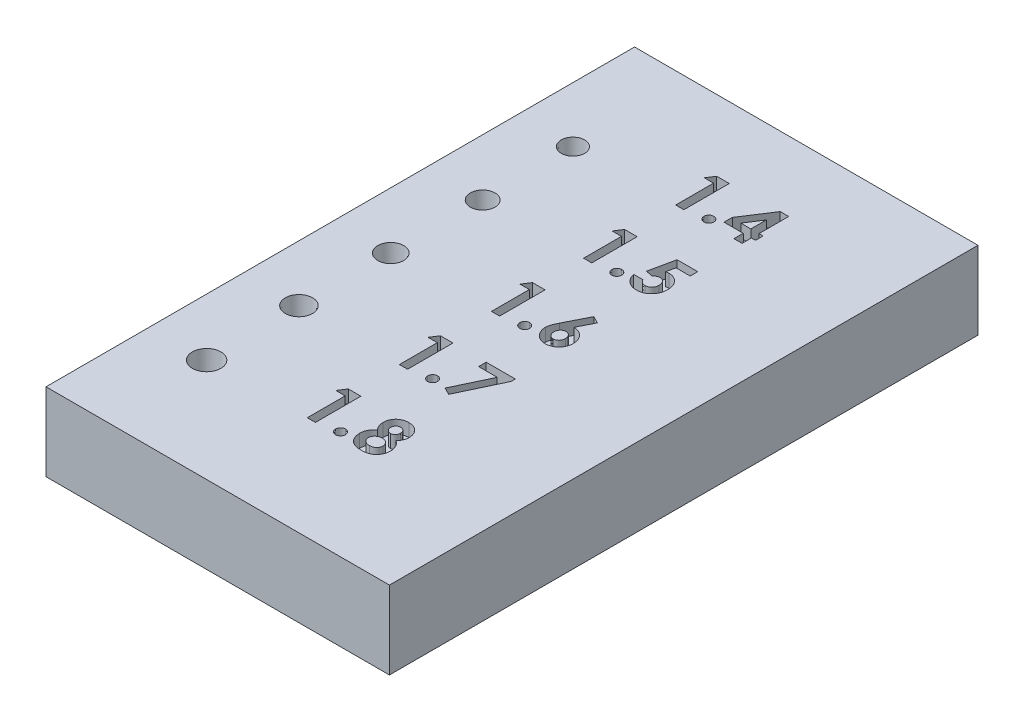
from build123d import *

# Parameters (mm, degrees)
SKETCH1_W           = 26.454374799
SKETCH1_H           = 45.335715324
BOSS_EXTRUDE1_DEPTH = 6
CUT_EXTRUDE1_DEPTH  = 1


with BuildPart() as part:
    # Sketch1 → Boss-Extrude1 (new body)
    with BuildSketch(Plane(origin=(0, 0, 0), x_dir=(1, 0, 0), z_dir=(0, 1, 0))):
        with Locations((13.227187399, 22.667857662)):
            Rectangle(SKETCH1_W, SKETCH1_H)
    extrude(amount=BOSS_EXTRUDE1_DEPTH)

    # Sketch4 → Cut-Extrude1 (cut)
    # profile 1 of 15: a face of its own
    with BuildSketch(Plane(origin=(0, 6, 0), x_dir=(1, 0, 0), z_dir=(0, 1, 0))):
        Polygon((16.587292701, 39.965877523), (17.242140457, 39.965877523), (17.242140457, 37.677415984), (17.556243021, 37.677415984), (17.556243021, 37.094082651), (17.242140457, 37.094082651), (17.242140457, 36.376133933), (16.613935329, 36.376133933), (16.613935329, 37.094082651), (15.133166098, 37.094082651), (15.133166098, 37.730000119), align=None)
        Polygon((16.613935329, 37.677415984), (16.613935329, 38.868621914), (15.839195746, 37.677415984), align=None, mode=Mode.SUBTRACT)
    # profile 2 of 15: a face of its own
    with BuildSketch(Plane(origin=(0, 6, 0), x_dir=(1, 0, 0), z_dir=(0, 1, 0))):
        with BuildLine():
            add(Edge.make_bspline(
                [(14.347909688, 37.094082651), (14.373269584, 37.092692229), (14.42319884, 37.089954728), (14.495339806, 37.069525043), (14.560447444, 37.032820204), (14.618662372, 36.984945104), (14.667887449, 36.927344966), (14.703466221, 36.86165905), (14.725622015, 36.789796053), (14.72806803, 36.739709714), (14.729319944, 36.714074638)],
                knots=[0, 0, 0, 0, 1.016957001, 2.002212695, 2.9757545, 3.99499976, 5.013036768, 5.994806404, 6.97370641, 8, 8, 8, 8], degree=3))
            add(Edge.make_bspline(
                [(14.729319944, 36.714074638), (14.728076232, 36.688435446), (14.72564624, 36.638341063), (14.703312905, 36.566338035), (14.667940615, 36.500112241), (14.618658423, 36.44189488), (14.560688533, 36.393117528), (14.495190113, 36.356751161), (14.423336267, 36.335162553), (14.373293773, 36.332574785), (14.347909688, 36.331262138)],
                knots=[0, 0, 0, 0, 1.023218912, 1.999186227, 2.986238111, 4.008388923, 5.030539734, 6.0011649, 6.986089706, 8, 8, 8, 8], degree=3))
            add(Edge.make_bspline(
                [(14.347909688, 36.331262138), (14.322519588, 36.332564111), (14.272465237, 36.335130836), (14.200499699, 36.356933132), (14.134517719, 36.392874732), (14.076533264, 36.441954047), (14.0270309, 36.499906089), (13.992664277, 36.566546989), (13.970122913, 36.638313917), (13.967726142, 36.688426256), (13.966499431, 36.714074638)],
                knots=[0, 0, 0, 0, 1.013427518, 1.99788335, 2.976245624, 3.997909735, 5.019573847, 6.001765691, 6.977268297, 8, 8, 8, 8], degree=3))
            add(Edge.make_bspline(
                [(13.966499431, 36.714074638), (13.967734235, 36.739719064), (13.970146819, 36.789823671), (13.992511398, 36.861447689), (14.027085979, 36.927552238), (14.076529135, 36.984885814), (14.134760049, 37.033061105), (14.200349165, 37.069345566), (14.272602594, 37.089986679), (14.322543748, 37.092702991), (14.347909688, 37.094082651)],
                knots=[0, 0, 0, 0, 1.025808215, 2.00424526, 2.981110158, 3.998665696, 5.017428914, 5.998734231, 6.983523959, 8, 8, 8, 8], degree=3))
        make_face()
    # profile 3 of 15: a face of its own
    with BuildSketch(Plane(origin=(0, 6, 0), x_dir=(1, 0, 0), z_dir=(0, 1, 0))):
        Polygon((11.783907284, 39.876133933), (12.75496097, 39.876133933), (12.75496097, 36.376133933), (12.126755842, 36.376133933), (12.126755842, 39.2928006), (11.408807124, 39.2928006), align=None)
    # profile 4 of 15: a face of its own
    with BuildSketch(Plane(origin=(0, 6, 0), x_dir=(1, 0, 0), z_dir=(0, 1, 0))):
        with BuildLine():
            Line((15.827977797, 32.78210045), (17.421627637, 32.78210045))
            Line((17.421627637, 32.78210045), (17.421627637, 32.198767116))
            Line((17.421627637, 32.198767116), (16.325774271, 32.198767116))
            Line((16.325774271, 32.198767116), (16.189055521, 31.536908142))
            add(Edge.make_bspline(
                [(16.189055521, 31.536908142), (16.207685408, 31.542096801), (16.244427372, 31.552329902), (16.299779187, 31.562592407), (16.35342281, 31.569244237), (16.388623428, 31.570131502), (16.405702156, 31.570561988)],
                knots=[0, 0, 0, 0, 1.05461699, 2.079921384, 3.068411212, 4, 4, 4, 4], degree=3))
            add(Edge.make_bspline(
                [(16.405702156, 31.570561988), (16.442918494, 31.569709197), (16.516280094, 31.568028159), (16.623598806, 31.55206962), (16.726362812, 31.526935404), (16.824257644, 31.491088827), (16.917187671, 31.444433582), (17.005265543, 31.387993813), (17.08859936, 31.321670392), (17.165708763, 31.245421795), (17.236560104, 31.161699109), (17.298161304, 31.071144165), (17.350772573, 30.97504819), (17.392617757, 30.872813851), (17.425645544, 30.76508325), (17.44951216, 30.651787349), (17.463625682, 30.532791877), (17.465528804, 30.451609774), (17.466499431, 30.410205418)],
                knots=[0, 0, 0, 0, 1.01440847, 1.999622559, 2.951875003, 3.895578053, 4.836219714, 5.782137149, 6.743708247, 7.735272588, 8.734977101, 9.730283169, 10.717124674, 11.717316708, 12.737475749, 13.78628267, 14.87096371, 16, 16, 16, 16], degree=3))
            add(Edge.make_bspline(
                [(17.466499431, 30.410205418), (17.46531331, 30.368331026), (17.462972745, 30.285700612), (17.447702703, 30.164204674), (17.420750805, 30.047838994), (17.383729676, 29.936292062), (17.334956709, 29.830383724), (17.27630054, 29.729016847), (17.206769453, 29.632943845), (17.127045786, 29.543149583), (17.040375702, 29.461075903), (16.948092521, 29.38887553), (16.850844561, 29.328119501), (16.748629476, 29.279018359), (16.642033705, 29.240170408), (16.531024897, 29.211890955), (16.415063561, 29.19567426), (16.336340881, 29.193474811), (16.296327156, 29.19235686)],
                knots=[0, 0, 0, 0, 1.06808661, 2.107647099, 3.116961351, 4.110378221, 5.100014249, 6.085620622, 7.093190682, 8.119403071, 9.144090782, 10.133780668, 11.103064255, 12.062861538, 13.020824475, 13.992378307, 14.979551724, 16, 16, 16, 16], degree=3))
            add(Edge.make_bspline(
                [(16.296327156, 29.19235686), (16.260544072, 29.193271414), (16.189972343, 29.195075105), (16.086023284, 29.206161543), (15.985804848, 29.225762468), (15.889849086, 29.254130082), (15.797146381, 29.289044139), (15.708768404, 29.332710766), (15.624229503, 29.38429849), (15.543769736, 29.442865835), (15.468696461, 29.508839678), (15.40017753, 29.581059416), (15.337798121, 29.658614755), (15.282893056, 29.742462491), (15.235634446, 29.832478745), (15.193724546, 29.927602654), (15.159420873, 30.028827616), (15.142012747, 30.099002383), (15.133166098, 30.134664552)],
                knots=[0, 0, 0, 0, 1.054957082, 2.080596141, 3.077793124, 4.061112343, 5.027190972, 5.994718051, 6.962465889, 7.943658696, 8.924948258, 9.904494768, 10.875059, 11.855380583, 12.854004648, 13.869083016, 14.917087635, 16, 16, 16, 16], degree=3))
            Line((15.133166098, 30.134664552), (15.851114816, 30.134664552))
            add(Edge.make_bspline(
                [(15.851114816, 30.134664552), (15.864238936, 30.109952121), (15.889744165, 30.061926331), (15.93826075, 29.998164878), (15.992571986, 29.943791851), (16.052187958, 29.898276012), (16.117494938, 29.86417632), (16.185831792, 29.838316691), (16.258057006, 29.82337337), (16.307245565, 29.821505306), (16.332084367, 29.820561988)],
                knots=[0, 0, 0, 0, 1.104910296, 2.147267069, 3.153527244, 4.136738762, 5.099945312, 6.05603338, 7.018353, 8, 8, 8, 8], degree=3))
            add(Edge.make_bspline(
                [(16.332084367, 29.820561988), (16.349396679, 29.821213358), (16.383458944, 29.822494938), (16.433644305, 29.829274818), (16.481548438, 29.842115759), (16.527527496, 29.859897475), (16.571704993, 29.882073285), (16.613447629, 29.9100688), (16.653481649, 29.942292675), (16.691197574, 29.979269681), (16.725357331, 30.020490441), (16.755311701, 30.064784959), (16.782095039, 30.111168999), (16.801933867, 30.161479951), (16.81818019, 30.214215511), (16.830144639, 30.269773479), (16.837294746, 30.328218744), (16.837956655, 30.368117688), (16.838294303, 30.388470642)],
                knots=[0, 0, 0, 0, 0.978869489, 1.925942215, 2.855067702, 3.774946051, 4.70828698, 5.642468714, 6.60995405, 7.609372294, 8.622401667, 9.629904756, 10.629323, 11.642352373, 12.678539694, 13.745912462, 14.850161547, 16, 16, 16, 16], degree=3))
            add(Edge.make_bspline(
                [(16.838294303, 30.388470642), (16.837902424, 30.408351158), (16.837139621, 30.447049064), (16.830829562, 30.503871453), (16.819540988, 30.557785616), (16.80416021, 30.609204496), (16.784470977, 30.657815852), (16.760409419, 30.703909043), (16.731872741, 30.747251085), (16.698707737, 30.786959577), (16.663340918, 30.823381334), (16.625345589, 30.855235513), (16.58506407, 30.88167227), (16.543748058, 30.904752327), (16.499748366, 30.92154949), (16.454054372, 30.933117077), (16.406714128, 30.941604906), (16.374424375, 30.942103597), (16.358025874, 30.94235686)],
                knots=[0, 0, 0, 0, 1.166249705, 2.270133367, 3.348514167, 4.393962215, 5.415026464, 6.420877785, 7.440098956, 8.453121383, 9.451844239, 10.415694839, 11.355045125, 12.27538808, 13.187007209, 14.108269027, 15.039275622, 16, 16, 16, 16], degree=3))
            add(Edge.make_bspline(
                [(16.358025874, 30.94235686), (16.34021329, 30.941680971), (16.304513051, 30.940326346), (16.251471431, 30.929304118), (16.199069345, 30.911466019), (16.147015385, 30.886855533), (16.095826275, 30.854648174), (16.04415111, 30.816872634), (15.993719569, 30.770784161), (15.961653792, 30.736457363), (15.945065137, 30.718699008)],
                knots=[0, 0, 0, 0, 0.88288272, 1.769486374, 2.674910571, 3.623812639, 4.617874466, 5.670434592, 6.794841017, 8, 8, 8, 8], degree=3))
            Line((15.945065137, 30.718699008), (15.416419303, 30.839993078))
            Line((15.416419303, 30.839993078), (15.827977797, 32.78210045))
        make_face()
    # profile 5 of 15: a face of its own
    with BuildSketch(Plane(origin=(0, 6, 0), x_dir=(1, 0, 0), z_dir=(0, 1, 0))):
        with BuildLine():
            add(Edge.make_bspline(
                [(14.347909688, 30.000049168), (14.373269584, 29.998658746), (14.42319884, 29.995921244), (14.495339806, 29.97549156), (14.560447444, 29.938786721), (14.618662372, 29.89091162), (14.667887449, 29.833311482), (14.703466221, 29.767625567), (14.725622015, 29.69576257), (14.72806803, 29.64567623), (14.729319944, 29.620041155)],
                knots=[0, 0, 0, 0, 1.016957001, 2.002212695, 2.9757545, 3.99499976, 5.013036768, 5.994806404, 6.97370641, 8, 8, 8, 8], degree=3))
            add(Edge.make_bspline(
                [(14.729319944, 29.620041155), (14.728076232, 29.594401963), (14.72564624, 29.544307579), (14.703312905, 29.472304551), (14.667940615, 29.406078758), (14.618658423, 29.347861397), (14.560688533, 29.299084045), (14.495190113, 29.262717678), (14.423336267, 29.24112907), (14.373293773, 29.238541302), (14.347909688, 29.237228655)],
                knots=[0, 0, 0, 0, 1.023218912, 1.999186227, 2.986238111, 4.008388923, 5.030539734, 6.0011649, 6.986089706, 8, 8, 8, 8], degree=3))
            add(Edge.make_bspline(
                [(14.347909688, 29.237228655), (14.322519588, 29.238530628), (14.272465237, 29.241097353), (14.200499699, 29.262899649), (14.134517719, 29.298841249), (14.076533264, 29.347920563), (14.0270309, 29.405872605), (13.992664277, 29.472513505), (13.970122913, 29.544280433), (13.967726142, 29.594392772), (13.966499431, 29.620041155)],
                knots=[0, 0, 0, 0, 1.013427518, 1.99788335, 2.976245624, 3.997909735, 5.019573847, 6.001765691, 6.977268297, 8, 8, 8, 8], degree=3))
            add(Edge.make_bspline(
                [(13.966499431, 29.620041155), (13.967734235, 29.64568558), (13.970146819, 29.695790188), (13.992511398, 29.767414206), (14.027085979, 29.833518755), (14.076529135, 29.89085233), (14.134760049, 29.939027622), (14.200349165, 29.975312082), (14.272602594, 29.995953196), (14.322543748, 29.998669508), (14.347909688, 30.000049168)],
                knots=[0, 0, 0, 0, 1.025808215, 2.00424526, 2.981110158, 3.998665696, 5.017428914, 5.998734231, 6.983523959, 8, 8, 8, 8], degree=3))
        make_face()
    # profile 6 of 15: a face of its own
    with BuildSketch(Plane(origin=(0, 6, 0), x_dir=(1, 0, 0), z_dir=(0, 1, 0))):
        Polygon((11.783907284, 32.78210045), (12.75496097, 32.78210045), (12.75496097, 29.28210045), (12.126755842, 29.28210045), (12.126755842, 32.198767116), (11.408807124, 32.198767116), align=None)
    # profile 7 of 15: a face of its own
    with BuildSketch(Plane(origin=(0, 6, 0), x_dir=(1, 0, 0), z_dir=(0, 1, 0))):
        with BuildLine():
            Line((16.420425713, 25.777810556), (16.976415297, 25.495959595))
            Line((16.976415297, 25.495959595), (16.366439335, 24.297041326))
            add(Edge.make_bspline(
                [(16.366439335, 24.297041326), (16.402476143, 24.296108314), (16.473456545, 24.294270596), (16.577889804, 24.279417849), (16.677729943, 24.25374101), (16.773983647, 24.219706429), (16.865474305, 24.173997649), (16.953675425, 24.119624671), (17.0363052, 24.053310976), (17.115258259, 23.97983892), (17.18704987, 23.898442442), (17.249413576, 23.81097934), (17.303762445, 23.719577602), (17.346011068, 23.622192351), (17.380090215, 23.520437856), (17.404679819, 23.413907363), (17.418708876, 23.302292381), (17.420643016, 23.226467268), (17.421627637, 23.187866646)],
                knots=[0, 0, 0, 0, 1.013260694, 1.995783107, 2.958651975, 3.908806537, 4.861209129, 5.829647963, 6.817170299, 7.835534541, 8.860094905, 9.863329007, 10.853101798, 11.844815043, 12.84250023, 13.867713965, 14.914507806, 16, 16, 16, 16], degree=3))
            add(Edge.make_bspline(
                [(17.421627637, 23.187866646), (17.420704965, 23.150657988), (17.41888124, 23.077112425), (17.403805735, 22.969092699), (17.379442927, 22.865454089), (17.344623583, 22.766403574), (17.30036538, 22.671456992), (17.246240596, 22.580670059), (17.18180037, 22.494721196), (17.10870966, 22.414067094), (17.028808906, 22.340550284), (16.944589158, 22.275204264), (16.855336751, 22.221225973), (16.762738658, 22.17564004), (16.665090092, 22.141623059), (16.563852369, 22.115946131), (16.458257773, 22.101129429), (16.386582867, 22.099266212), (16.350313534, 22.098323377)],
                knots=[0, 0, 0, 0, 1.049934834, 2.075270938, 3.072134561, 4.05064612, 5.033440221, 6.024524368, 7.028587226, 8.060776465, 9.092543989, 10.090062252, 11.064205434, 12.031961459, 12.998029633, 13.977230324, 14.976426867, 16, 16, 16, 16], degree=3))
            add(Edge.make_bspline(
                [(16.350313534, 22.098323377), (16.312386833, 22.099097112), (16.237809107, 22.100618557), (16.128683229, 22.117654734), (16.024022121, 22.143300322), (15.924413994, 22.179917866), (15.829239415, 22.226543362), (15.739618893, 22.284237724), (15.654797499, 22.352364737), (15.575679555, 22.429391652), (15.504400182, 22.513764098), (15.44082494, 22.601364664), (15.387040202, 22.692330814), (15.343502711, 22.786565289), (15.309533751, 22.883767805), (15.285898283, 22.984122847), (15.270497594, 23.087364221), (15.268692215, 23.157429659), (15.267781483, 23.192774499)],
                knots=[0, 0, 0, 0, 1.063775006, 2.091769615, 3.092589432, 4.084662827, 5.064601646, 6.061867366, 7.070035304, 8.113879863, 9.156342271, 10.166834137, 11.149076039, 12.117706134, 13.076241869, 14.034148791, 15.008317125, 16, 16, 16, 16], degree=3))
            add(Edge.make_bspline(
                [(15.267781483, 23.192774499), (15.268262696, 23.220144942), (15.2692278, 23.275038184), (15.278926524, 23.357237831), (15.293671991, 23.439653245), (15.310763918, 23.50919798), (15.328363458, 23.568005332), (15.34607753, 23.617772405), (15.368030219, 23.673002974), (15.393125394, 23.733838075), (15.422152208, 23.800204525), (15.454959029, 23.871921424), (15.491627532, 23.949531869), (15.517777225, 24.002838226), (15.531403278, 24.030615043)],
                knots=[0, 0, 0, 0, 1.110454016, 2.227089276, 3.35462975, 4.507227546, 5.131400587, 5.845402449, 6.650387134, 7.543487832, 8.516250726, 9.590168902, 10.744287919, 12, 12, 12, 12], degree=3))
            Line((15.531403278, 24.030615043), (16.420425713, 25.777810556))
        make_face()
        with BuildLine():
            add(Edge.make_bspline(
                [(16.336291098, 23.713707992), (16.306147904, 23.712325388), (16.24716163, 23.709619812), (16.16329197, 23.681285705), (16.086821869, 23.636836544), (16.020536639, 23.574932491), (15.965095144, 23.500954717), (15.924354788, 23.416573185), (15.8998472, 23.322913942), (15.897301018, 23.25742896), (15.895986611, 23.223623858)],
                knots=[0, 0, 0, 0, 0.981744412, 1.921144944, 2.858899012, 3.85339082, 4.86292663, 5.863643845, 6.897155691, 8, 8, 8, 8], degree=3))
            add(Edge.make_bspline(
                [(15.895986611, 23.223623858), (15.89754291, 23.189807498), (15.900570016, 23.124032417), (15.925999122, 23.029481371), (15.967634458, 22.943183632), (16.026025363, 22.868225491), (16.094575445, 22.806004432), (16.170589356, 22.759988983), (16.252799155, 22.731720182), (16.309665682, 22.728271014), (16.338394463, 22.726528505)],
                knots=[0, 0, 0, 0, 1.098279937, 2.136227893, 3.159405121, 4.194678092, 5.206500211, 6.154139736, 7.067477469, 8, 8, 8, 8], degree=3))
            add(Edge.make_bspline(
                [(16.338394463, 22.726528505), (16.368735304, 22.728302049), (16.428238963, 22.731780277), (16.514076892, 22.758859578), (16.592490356, 22.804104117), (16.661823026, 22.866125971), (16.721378472, 22.940228738), (16.762584825, 23.027033378), (16.78918953, 23.12226686), (16.79197988, 23.18908069), (16.793422508, 23.223623858)],
                knots=[0, 0, 0, 0, 0.96921794, 1.900804717, 2.848419905, 3.844199796, 4.861108892, 5.867439427, 6.897452859, 8, 8, 8, 8], degree=3))
            add(Edge.make_bspline(
                [(16.793422508, 23.223623858), (16.791779091, 23.257409222), (16.788596421, 23.322838525), (16.764690801, 23.41693654), (16.722008929, 23.500992835), (16.665313025, 23.57523786), (16.59674661, 23.63711431), (16.517216019, 23.681636245), (16.429515053, 23.709569613), (16.36781882, 23.71230842), (16.336291098, 23.713707992)],
                knots=[0, 0, 0, 0, 1.083229974, 2.097801324, 3.086792542, 4.086858909, 5.079819718, 6.026392613, 6.991456328, 8, 8, 8, 8], degree=3))
        make_face(mode=Mode.SUBTRACT)
    # profile 8 of 15: a face of its own
    with BuildSketch(Plane(origin=(0, 6, 0), x_dir=(1, 0, 0), z_dir=(0, 1, 0))):
        with BuildLine():
            add(Edge.make_bspline(
                [(14.347909688, 22.906015684), (14.373269584, 22.904625262), (14.42319884, 22.901887761), (14.495339806, 22.881458077), (14.560447444, 22.844753238), (14.618662372, 22.796878137), (14.667887449, 22.739277999), (14.703466221, 22.673592084), (14.725622015, 22.601729086), (14.72806803, 22.551642747), (14.729319944, 22.526007672)],
                knots=[0, 0, 0, 0, 1.016957001, 2.002212695, 2.9757545, 3.99499976, 5.013036768, 5.994806404, 6.97370641, 8, 8, 8, 8], degree=3))
            add(Edge.make_bspline(
                [(14.729319944, 22.526007672), (14.728076232, 22.500368479), (14.72564624, 22.450274096), (14.703312905, 22.378271068), (14.667940615, 22.312045275), (14.618658423, 22.253827913), (14.560688533, 22.205050561), (14.495190113, 22.168684195), (14.423336267, 22.147095586), (14.373293773, 22.144507818), (14.347909688, 22.143195172)],
                knots=[0, 0, 0, 0, 1.023218912, 1.999186227, 2.986238111, 4.008388923, 5.030539734, 6.0011649, 6.986089706, 8, 8, 8, 8], degree=3))
            add(Edge.make_bspline(
                [(14.347909688, 22.143195172), (14.322519588, 22.144497144), (14.272465237, 22.147063869), (14.200499699, 22.168866166), (14.134517719, 22.204807766), (14.076533264, 22.25388708), (14.0270309, 22.311839122), (13.992664277, 22.378480022), (13.970122913, 22.45024695), (13.967726142, 22.500359289), (13.966499431, 22.526007672)],
                knots=[0, 0, 0, 0, 1.013427518, 1.99788335, 2.976245624, 3.997909735, 5.019573847, 6.001765691, 6.977268297, 8, 8, 8, 8], degree=3))
            add(Edge.make_bspline(
                [(13.966499431, 22.526007672), (13.967734235, 22.551652097), (13.970146819, 22.601756705), (13.992511398, 22.673380723), (14.027085979, 22.739485272), (14.076529135, 22.796818847), (14.134760049, 22.844994138), (14.200349165, 22.881278599), (14.272602594, 22.901919712), (14.322543748, 22.904636025), (14.347909688, 22.906015684)],
                knots=[0, 0, 0, 0, 1.025808215, 2.00424526, 2.981110158, 3.998665696, 5.017428914, 5.998734231, 6.983523959, 8, 8, 8, 8], degree=3))
        make_face()
    # profile 9 of 15: a face of its own
    with BuildSketch(Plane(origin=(0, 6, 0), x_dir=(1, 0, 0), z_dir=(0, 1, 0))):
        Polygon((11.783907284, 25.688066967), (12.75496097, 25.688066967), (12.75496097, 22.188066967), (12.126755842, 22.188066967), (12.126755842, 25.104733633), (11.408807124, 25.104733633), align=None)
    # profile 10 of 15: a face of its own
    with BuildSketch(Plane(origin=(0, 6, 0), x_dir=(1, 0, 0), z_dir=(0, 1, 0))):
        Polygon((15.312653278, 18.594033483), (17.556243021, 18.594033483), (17.556243021, 18.268011849), (16.012372829, 15.004289894), (15.455682124, 15.284738611), (16.745746226, 18.01070015), (15.312653278, 18.01070015), align=None)
    # profile 11 of 15: a face of its own
    with BuildSketch(Plane(origin=(0, 6, 0), x_dir=(1, 0, 0), z_dir=(0, 1, 0))):
        with BuildLine():
            add(Edge.make_bspline(
                [(14.347909688, 15.811982201), (14.373269584, 15.810591779), (14.42319884, 15.807854278), (14.495339806, 15.787424593), (14.560447444, 15.750719754), (14.618662372, 15.702844654), (14.667887449, 15.645244516), (14.703466221, 15.579558601), (14.725622015, 15.507695603), (14.72806803, 15.457609264), (14.729319944, 15.431974188)],
                knots=[0, 0, 0, 0, 1.016957001, 2.002212695, 2.9757545, 3.99499976, 5.013036768, 5.994806404, 6.97370641, 8, 8, 8, 8], degree=3))
            add(Edge.make_bspline(
                [(14.729319944, 15.431974188), (14.728076232, 15.406334996), (14.72564624, 15.356240613), (14.703312905, 15.284237585), (14.667940615, 15.218011791), (14.618658423, 15.15979443), (14.560688533, 15.111017078), (14.495190113, 15.074650712), (14.423336267, 15.053062103), (14.373293773, 15.050474335), (14.347909688, 15.049161688)],
                knots=[0, 0, 0, 0, 1.023218912, 1.999186227, 2.986238111, 4.008388923, 5.030539734, 6.0011649, 6.986089706, 8, 8, 8, 8], degree=3))
            add(Edge.make_bspline(
                [(14.347909688, 15.049161688), (14.322519588, 15.050463661), (14.272465237, 15.053030386), (14.200499699, 15.074832682), (14.134517719, 15.110774282), (14.076533264, 15.159853597), (14.0270309, 15.217805639), (13.992664277, 15.284446539), (13.970122913, 15.356213467), (13.967726142, 15.406325806), (13.966499431, 15.431974188)],
                knots=[0, 0, 0, 0, 1.013427518, 1.99788335, 2.976245624, 3.997909735, 5.019573847, 6.001765691, 6.977268297, 8, 8, 8, 8], degree=3))
            add(Edge.make_bspline(
                [(13.966499431, 15.431974188), (13.967734235, 15.457618614), (13.970146819, 15.507723221), (13.992511398, 15.57934724), (14.027085979, 15.645451788), (14.076529135, 15.702785364), (14.134760049, 15.750960655), (14.200349165, 15.787245116), (14.272602594, 15.807886229), (14.322543748, 15.810602541), (14.347909688, 15.811982201)],
                knots=[0, 0, 0, 0, 1.025808215, 2.00424526, 2.981110158, 3.998665696, 5.017428914, 5.998734231, 6.983523959, 8, 8, 8, 8], degree=3))
        make_face()
    # profile 12 of 15: a face of its own
    with BuildSketch(Plane(origin=(0, 6, 0), x_dir=(1, 0, 0), z_dir=(0, 1, 0))):
        Polygon((11.783907284, 18.594033483), (12.75496097, 18.594033483), (12.75496097, 15.094033483), (12.126755842, 15.094033483), (12.126755842, 18.01070015), (11.408807124, 18.01070015), align=None)
    # profile 13 of 15: a face of its own
    with BuildSketch(Plane(origin=(0, 6, 0), x_dir=(1, 0, 0), z_dir=(0, 1, 0))):
        with BuildLine():
            add(Edge.make_bspline(
                [(17.076675713, 9.884615385), (17.113377622, 9.85839088), (17.186025738, 9.806481838), (17.281967325, 9.713484848), (17.36460648, 9.609745628), (17.433075402, 9.495900492), (17.487930636, 9.374747784), (17.527198661, 9.247582481), (17.552141259, 9.115526214), (17.554865736, 9.025618623), (17.556243021, 8.980168269)],
                knots=[0, 0, 0, 0, 1.013736912, 2.006600758, 2.994453809, 3.989973287, 4.987781207, 5.978959008, 6.978317308, 8, 8, 8, 8], degree=3))
            add(Edge.make_bspline(
                [(17.556243021, 8.980168269), (17.554581431, 8.930953536), (17.551285881, 8.833342428), (17.522148809, 8.690195753), (17.47537041, 8.552673083), (17.411438599, 8.422292319), (17.331279866, 8.303105196), (17.237847408, 8.197590627), (17.131023446, 8.108504305), (17.031567311, 8.048059811), (16.945961941, 8.007907676), (16.876879159, 7.982211116), (16.803932282, 7.95958889), (16.726600771, 7.941515233), (16.64489869, 7.927405777), (16.558942635, 7.918087919), (16.468676024, 7.911314404), (16.407118012, 7.910615021), (16.375553919, 7.91025641)],
                knots=[0, 0, 0, 0, 1.313679292, 2.605514271, 3.884962679, 5.186178731, 6.472827995, 7.711026938, 8.938935107, 10.174644318, 10.808706728, 11.462743532, 12.142127587, 12.847854939, 13.582806024, 14.355735269, 15.156897313, 16, 16, 16, 16], degree=3))
            add(Edge.make_bspline(
                [(16.375553919, 7.91025641), (16.341893944, 7.910712993), (16.276162652, 7.91160461), (16.180209606, 7.916995796), (16.089697537, 7.926935052), (16.004436581, 7.940019313), (15.924508767, 7.957333583), (15.849911728, 7.979287129), (15.780465342, 8.004283683), (15.695459318, 8.042343082), (15.598312848, 8.101780984), (15.493315081, 8.188826078), (15.401153905, 8.292499504), (15.321028492, 8.409891165), (15.25787062, 8.540278868), (15.210904545, 8.679570167), (15.183090678, 8.8273876), (15.1797422, 8.928635274), (15.178037893, 8.980168269)],
                knots=[0, 0, 0, 0, 0.886964665, 1.7320671, 2.531131818, 3.285397207, 4.004107883, 4.684213108, 5.332925796, 5.947568694, 7.135706876, 8.320776993, 9.52873045, 10.778999824, 12.05415135, 13.333578234, 14.642845846, 16, 16, 16, 16], degree=3))
            add(Edge.make_bspline(
                [(15.178037893, 8.980168269), (15.179595344, 9.02512233), (15.182655924, 9.113462503), (15.204579271, 9.242908796), (15.242171149, 9.365639198), (15.293753057, 9.482508108), (15.360267052, 9.59352853), (15.442106459, 9.697883573), (15.538233636, 9.796514663), (15.611128671, 9.854761362), (15.648490617, 9.884615385)],
                knots=[0, 0, 0, 0, 1.01821053, 2.000906977, 2.963938143, 3.919209931, 4.888045165, 5.887808425, 6.917407893, 8, 8, 8, 8], degree=3))
            add(Edge.make_bspline(
                [(15.648490617, 9.884615385), (15.625328192, 9.911329853), (15.579728352, 9.963922597), (15.520721711, 10.048566426), (15.471011101, 10.135834303), (15.428804426, 10.225018003), (15.397604176, 10.317653045), (15.374009594, 10.412283019), (15.360664522, 10.509871987), (15.358578646, 10.575649851), (15.357525072, 10.608874199)],
                knots=[0, 0, 0, 0, 1.061529281, 2.089831458, 3.092927091, 4.075998741, 5.048384512, 6.024008542, 7.00192825, 8, 8, 8, 8], degree=3))
            add(Edge.make_bspline(
                [(15.357525072, 10.608874199), (15.358921951, 10.653850171), (15.361677939, 10.742586032), (15.386087564, 10.872338813), (15.426613468, 10.995629814), (15.481745512, 11.11209806), (15.55175464, 11.21920525), (15.63494064, 11.315256457), (15.732472944, 11.39673336), (15.840724589, 11.46664414), (15.960238181, 11.522250526), (16.08987979, 11.56115971), (16.228083972, 11.585791276), (16.323330169, 11.58840611), (16.37204831, 11.58974359)],
                knots=[0, 0, 0, 0, 1.022455555, 2.017265428, 2.990720743, 3.968117071, 4.939886797, 5.893155559, 6.847550415, 7.820889576, 8.817530429, 9.83499769, 10.892607882, 12, 12, 12, 12], degree=3))
            add(Edge.make_bspline(
                [(16.37204831, 11.58974359), (16.420064782, 11.588403921), (16.51368685, 11.585791847), (16.649462278, 11.561323492), (16.776302306, 11.521547598), (16.893158059, 11.464767113), (17.000290171, 11.394721588), (17.09616484, 11.310407735), (17.1790898, 11.211964217), (17.249680047, 11.102086196), (17.305929628, 10.983708548), (17.347514744, 10.859565009), (17.371568066, 10.730631358), (17.375019668, 10.643091493), (17.376755842, 10.599058494)],
                knots=[0, 0, 0, 0, 1.094655142, 2.134348324, 3.136019022, 4.118575226, 5.088726318, 6.048298823, 7.020513804, 8.015920439, 9.020015034, 10.003048569, 10.995523219, 12, 12, 12, 12], degree=3))
            add(Edge.make_bspline(
                [(17.376755842, 10.599058494), (17.375919485, 10.567938351), (17.374278198, 10.506867397), (17.362142851, 10.416892646), (17.341708416, 10.330561752), (17.313218188, 10.245788452), (17.273607044, 10.160268983), (17.220003957, 10.072364636), (17.15480284, 9.978422968), (17.103597146, 9.916940066), (17.076675713, 9.884615385)],
                knots=[0, 0, 0, 0, 0.940746401, 1.846144481, 2.739104268, 3.619506754, 4.545839139, 5.581956076, 6.728711598, 8, 8, 8, 8], degree=3))
        make_face()
        with BuildLine():
            add(Edge.make_bspline(
                [(16.35662363, 10.961538462), (16.330759113, 10.960291552), (16.280446913, 10.957866039), (16.208657295, 10.935973092), (16.144116086, 10.90016562), (16.088296567, 10.850887492), (16.042521651, 10.791095866), (16.008879603, 10.722353174), (15.988929471, 10.645507777), (15.986817362, 10.591699174), (15.985730201, 10.564002404)],
                knots=[0, 0, 0, 0, 1.018099191, 1.980427864, 2.929421084, 3.909248076, 4.895556904, 5.880788387, 6.909183412, 8, 8, 8, 8], degree=3))
            add(Edge.make_bspline(
                [(15.985730201, 10.564002404), (15.987073177, 10.536069098), (15.989695467, 10.481526625), (16.010316835, 10.403204778), (16.045466525, 10.332222912), (16.093726813, 10.270063604), (16.152370878, 10.219293679), (16.218034253, 10.180518436), (16.291445157, 10.158382655), (16.342458691, 10.155380965), (16.368542701, 10.153846154)],
                knots=[0, 0, 0, 0, 1.07118507, 2.091592095, 3.082435519, 4.092579768, 5.090825648, 6.043203473, 6.999459622, 8, 8, 8, 8], degree=3))
            add(Edge.make_bspline(
                [(16.368542701, 10.153846154), (16.395119842, 10.155035369), (16.446897101, 10.157352184), (16.520491303, 10.180062326), (16.586790273, 10.21638257), (16.643565546, 10.267731361), (16.690592913, 10.32991318), (16.724841858, 10.402135517), (16.744554314, 10.483041407), (16.747185997, 10.539587197), (16.748550713, 10.568910256)],
                knots=[0, 0, 0, 0, 1.008803858, 1.965339183, 2.900766489, 3.864508618, 4.855158575, 5.849593072, 6.884859315, 8, 8, 8, 8], degree=3))
            add(Edge.make_bspline(
                [(16.748550713, 10.568910256), (16.747151475, 10.596588717), (16.744445397, 10.650117887), (16.725041782, 10.726968269), (16.689406072, 10.794638052), (16.642585347, 10.854058384), (16.583884705, 10.901977186), (16.51573756, 10.937216962), (16.438645718, 10.957656374), (16.384556391, 10.96021641), (16.35662363, 10.961538462)],
                knots=[0, 0, 0, 0, 1.065910571, 2.061433587, 3.023559535, 3.990682701, 4.956464619, 5.918590567, 6.925120432, 8, 8, 8, 8], degree=3))
        make_face(mode=Mode.SUBTRACT)
        with BuildLine():
            add(Edge.make_bspline(
                [(16.376956162, 9.525641026), (16.357301087, 9.525314624), (16.31856118, 9.52467129), (16.261610332, 9.517252686), (16.206960142, 9.50619713), (16.15467841, 9.490946303), (16.10502926, 9.470155589), (16.057591834, 9.445091998), (16.012529959, 9.41550217), (15.970512027, 9.381923308), (15.932537635, 9.345067308), (15.898307175, 9.306627695), (15.870328607, 9.2656107), (15.84702913, 9.223379742), (15.828307869, 9.179600163), (15.8159317, 9.133551003), (15.80796318, 9.085845509), (15.806819781, 9.053350461), (15.806243021, 9.036959135)],
                knots=[0, 0, 0, 0, 1.129580664, 2.226389355, 3.296443603, 4.333934503, 5.352185725, 6.386189251, 7.41493955, 8.447544828, 9.47401038, 10.455044306, 11.4018853, 12.322125673, 13.225630306, 14.132028716, 15.057747923, 16, 16, 16, 16], degree=3))
            add(Edge.make_bspline(
                [(15.806243021, 9.036959135), (15.806517915, 9.0198646), (15.807063133, 8.985959705), (15.815297886, 8.936472773), (15.827154475, 8.888746025), (15.843807433, 8.843226213), (15.866077601, 8.799939838), (15.892668586, 8.758466064), (15.924507605, 8.719095711), (15.960731353, 8.682039869), (16.001283677, 8.648608885), (16.044990196, 8.619155605), (16.091273646, 8.593188086), (16.141523423, 8.57448525), (16.193878578, 8.557366772), (16.249741721, 8.546981403), (16.308502702, 8.539339561), (16.348649781, 8.538759229), (16.369243822, 8.538461538)],
                knots=[0, 0, 0, 0, 0.973817353, 1.931446211, 2.852767904, 3.776304432, 4.688323523, 5.623710549, 6.581246645, 7.570897993, 8.57436511, 9.572506873, 10.574556662, 11.591826551, 12.624694332, 13.712108235, 14.826391851, 16, 16, 16, 16], degree=3))
            add(Edge.make_bspline(
                [(16.369243822, 8.538461538), (16.390061335, 8.538838881), (16.430628074, 8.539574201), (16.489928489, 8.546073039), (16.546016157, 8.556384806), (16.598824084, 8.571133034), (16.648551965, 8.590026101), (16.694532742, 8.614073237), (16.737816233, 8.641325334), (16.777011519, 8.673163934), (16.812799705, 8.707861361), (16.843636251, 8.745886791), (16.869856224, 8.786017464), (16.89100549, 8.828686989), (16.908071048, 8.873693952), (16.91977695, 8.921487118), (16.927040884, 8.971529403), (16.927701989, 9.005616963), (16.928037893, 9.022936699)],
                knots=[0, 0, 0, 0, 1.200705402, 2.339794563, 3.437264955, 4.487414319, 5.499029866, 6.500076882, 7.476298407, 8.444948224, 9.407950986, 10.347155707, 11.263432813, 12.167927724, 13.089546445, 14.03463663, 15.00140776, 16, 16, 16, 16], degree=3))
            add(Edge.make_bspline(
                [(16.928037893, 9.022936699), (16.927396514, 9.040482865), (16.926142839, 9.074779539), (16.919282917, 9.125426645), (16.906414402, 9.173440894), (16.889578626, 9.219935855), (16.867183178, 9.263949395), (16.839379714, 9.305388621), (16.807732547, 9.345280033), (16.770744002, 9.381847811), (16.73030278, 9.415283757), (16.687259544, 9.445071515), (16.641746874, 9.470298998), (16.593640276, 9.490921213), (16.542763982, 9.506205066), (16.489506178, 9.517252297), (16.433954228, 9.52467295), (16.396144503, 9.525315124), (16.376956162, 9.525641026)],
                knots=[0, 0, 0, 0, 1.011708178, 1.977538892, 2.938094892, 3.871441737, 4.823268678, 5.775953079, 6.743660653, 7.753304209, 8.767430709, 9.76505158, 10.765940967, 11.761741361, 12.775867861, 13.822051386, 14.89469657, 16, 16, 16, 16], degree=3))
        make_face(mode=Mode.SUBTRACT)
    # profile 14 of 15: a face of its own
    with BuildSketch(Plane(origin=(0, 6, 0), x_dir=(1, 0, 0), z_dir=(0, 1, 0))):
        with BuildLine():
            add(Edge.make_bspline(
                [(14.347909688, 8.717948718), (14.373269584, 8.716558296), (14.42319884, 8.713820795), (14.495339806, 8.69339111), (14.560447444, 8.656686271), (14.618662372, 8.608811171), (14.667887449, 8.551211032), (14.703466221, 8.485525117), (14.725622015, 8.41366212), (14.72806803, 8.36357578), (14.729319944, 8.337940705)],
                knots=[0, 0, 0, 0, 1.016957001, 2.002212695, 2.9757545, 3.99499976, 5.013036768, 5.994806404, 6.97370641, 8, 8, 8, 8], degree=3))
            add(Edge.make_bspline(
                [(14.729319944, 8.337940705), (14.728076232, 8.312301513), (14.72564624, 8.262207129), (14.703312905, 8.190204101), (14.667940615, 8.123978308), (14.618658423, 8.065760947), (14.560688533, 8.016983595), (14.495190113, 7.980617228), (14.423336267, 7.95902862), (14.373293773, 7.956440852), (14.347909688, 7.955128205)],
                knots=[0, 0, 0, 0, 1.023218912, 1.999186227, 2.986238111, 4.008388923, 5.030539734, 6.0011649, 6.986089706, 8, 8, 8, 8], degree=3))
            add(Edge.make_bspline(
                [(14.347909688, 7.955128205), (14.322519588, 7.956430178), (14.272465237, 7.958996903), (14.200499699, 7.980799199), (14.134517719, 8.016740799), (14.076533264, 8.065820114), (14.0270309, 8.123772156), (13.992664277, 8.190413056), (13.970122913, 8.262179983), (13.967726142, 8.312292323), (13.966499431, 8.337940705)],
                knots=[0, 0, 0, 0, 1.013427518, 1.99788335, 2.976245624, 3.997909735, 5.019573847, 6.001765691, 6.977268297, 8, 8, 8, 8], degree=3))
            add(Edge.make_bspline(
                [(13.966499431, 8.337940705), (13.967734235, 8.363585131), (13.970146819, 8.413689738), (13.992511398, 8.485313756), (14.027085979, 8.551418305), (14.076529135, 8.608751881), (14.134760049, 8.656927172), (14.200349165, 8.693211633), (14.272602594, 8.713852746), (14.322543748, 8.716569058), (14.347909688, 8.717948718)],
                knots=[0, 0, 0, 0, 1.025808215, 2.00424526, 2.981110158, 3.998665696, 5.017428914, 5.998734231, 6.983523959, 8, 8, 8, 8], degree=3))
        make_face()
    # profile 15 of 15: a face of its own
    with BuildSketch(Plane(origin=(0, 6, 0), x_dir=(1, 0, 0), z_dir=(0, 1, 0))):
        Polygon((11.783907284, 11.5), (12.75496097, 11.5), (12.75496097, 8), (12.126755842, 8), (12.126755842, 10.916666667), (11.408807124, 10.916666667), align=None)
    extrude(amount=-CUT_EXTRUDE1_DEPTH, mode=Mode.SUBTRACT)

    # Sketch3 → Tap Drill for M2 Tap1 (revolve, cut)
    with BuildSketch(Plane(origin=(4.274132927, 6, -36.314723514), x_dir=(0, 0, 1), z_dir=(1, 0, 0))):
        Polygon((0, 0), (0, 6), (0.7, 6), (0.7, 2.077079416), (0.9, 0), align=None)
    revolve(axis=Axis((4.274132927, 12.35, -36.314723514), (0, -1, 0)), mode=Mode.SUBTRACT)

    # Sketch6 → Tap Drill for M2 Tap2 (revolve, cut)
    with BuildSketch(Plane(origin=(4.359654228, 6, -29.275702305), x_dir=(0, 0, 1), z_dir=(1, 0, 0))):
        Polygon((0, 0), (0, 6), (0.75, 6), (0.75, 2.077079416), (0.95, 0), align=None)
    revolve(axis=Axis((4.359654228, 12.35, -29.275702305), (0, -1, 0)), mode=Mode.SUBTRACT)

    # Sketch8 → Tap Drill for M2 Tap3 (revolve, cut)
    with BuildSketch(Plane(origin=(4.356574655, 6, -22.198248198), x_dir=(0, 0, 1), z_dir=(1, 0, 0))):
        Polygon((0, 0), (0, 6), (0.8, 6), (0.8, 2.077079416), (1, 0), align=None)
    revolve(axis=Axis((4.356574655, 12.35, -22.198248198), (0, -1, 0)), mode=Mode.SUBTRACT)

    # Sketch10 → Tap Drill for M2 Tap4 (revolve, cut)
    with BuildSketch(Plane(origin=(4.32989911, 6, -15.154525578), x_dir=(0, 0, 1), z_dir=(1, 0, 0))):
        Polygon((0, 0), (0, 6), (0.85, 6), (0.85, 2.077079416), (1.05, 0), align=None)
    revolve(axis=Axis((4.32989911, 12.35, -15.154525578), (0, -1, 0)), mode=Mode.SUBTRACT)

    # Sketch12 → Tap Drill for M2 Tap5 (revolve, cut)
    with BuildSketch(Plane(origin=(4.407740703, 6, -7.966318424), x_dir=(0, 0, 1), z_dir=(1, 0, 0))):
        Polygon((0, 0), (0, 6), (0.9, 6), (0.9, 2.077079416), (1.1, 0), align=None)
    revolve(axis=Axis((4.407740703, 12.35, -7.966318424), (0, -1, 0)), mode=Mode.SUBTRACT)


solid = part.part
